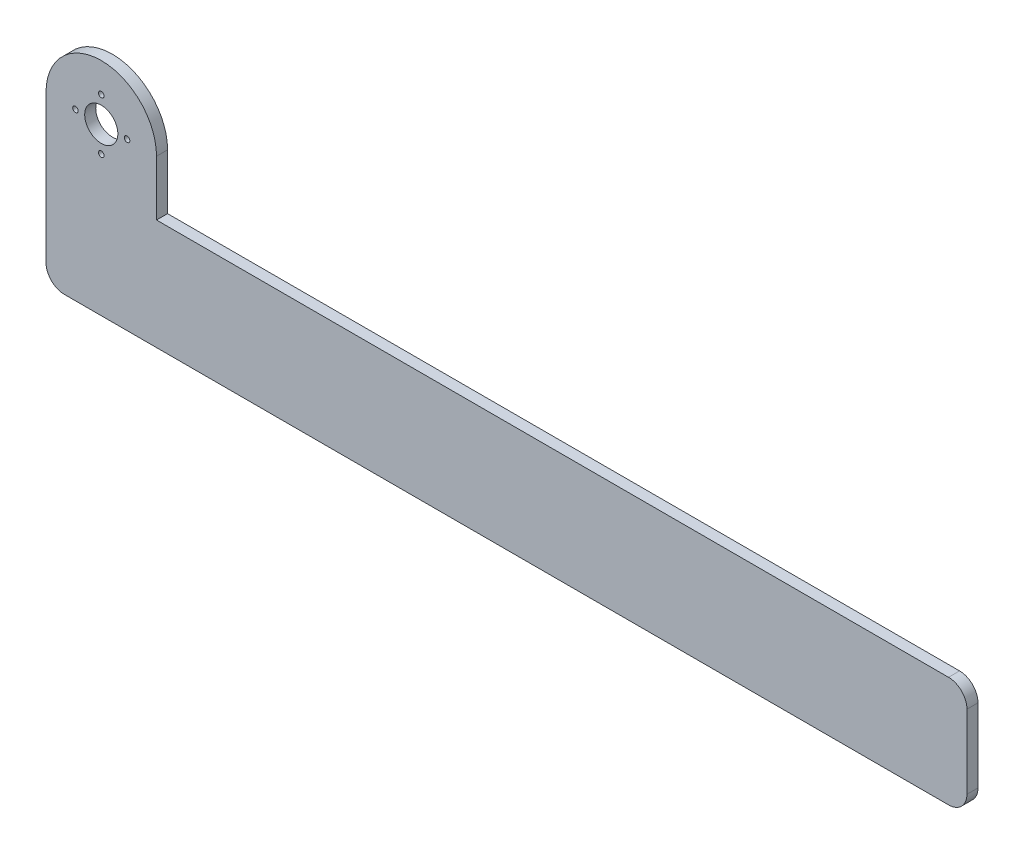
from build123d import *

# Parameters (mm, degrees)
SALIENTE_EXTRUIR1_DEPTH = 6
REDONDEO1_R             = 10
REDONDEO2_R             = 10
CROQUIS2_R              = 9
CORTAR_EXTRUIR1_DEPTH   = 476.984243437
CROQUIS3_R              = 1.5
CORTAR_EXTRUIR2_DEPTH   = 476.984243437


with BuildPart() as part:
    # Croquis1 → Saliente-Extruir1 (new body)
    with BuildSketch(Plane.XY):
        with BuildLine():
            Line((30, -45), (470, -45))
            Line((470, -45), (470, 15))
            Line((470, 15), (30, 15))
            Line((30, 15), (30, 45))
            ThreePointArc((30, 45), (0, 75), (-30, 45))
            Line((-30, 45), (-30, -45))
            Line((-30, -45), (30, -45))
        make_face()
    extrude(amount=-SALIENTE_EXTRUIR1_DEPTH)

    # Redondeo1
    redondeo1_edges = [part.edges().sort_by_distance(p)[0] for p in [
        (-30, -45, -3),
    ]]
    fillet(redondeo1_edges, radius=REDONDEO1_R)

    # Redondeo2
    redondeo2_edges = [part.edges().sort_by_distance(p)[0] for p in [
        (470, 15, -3),
        (470, -45, -3),
    ]]
    fillet(redondeo2_edges, radius=REDONDEO2_R)

    # Croquis2 → Cortar-Extruir1 (cut, through all)
    with BuildSketch(Plane(origin=(0, 0, -6), x_dir=(-1, 0, 0), z_dir=(0, 0, -1))):
        with Locations((0, 45)):
            Circle(CROQUIS2_R)
    extrude(amount=-CORTAR_EXTRUIR1_DEPTH, mode=Mode.SUBTRACT)

    # Croquis3 → Cortar-Extruir2 (cut, through all)
    with BuildSketch(Plane(origin=(0, 0, -6), x_dir=(-1, 0, 0), z_dir=(0, 0, -1))):
        with Locations((0, 31)):
            Circle(CROQUIS3_R)
        with Locations((14, 45)):
            Circle(CROQUIS3_R)
        with Locations((0, 59)):
            Circle(CROQUIS3_R)
        with Locations((-14, 45)):
            Circle(CROQUIS3_R)
    extrude(amount=-CORTAR_EXTRUIR2_DEPTH, mode=Mode.SUBTRACT)


solid = part.part
